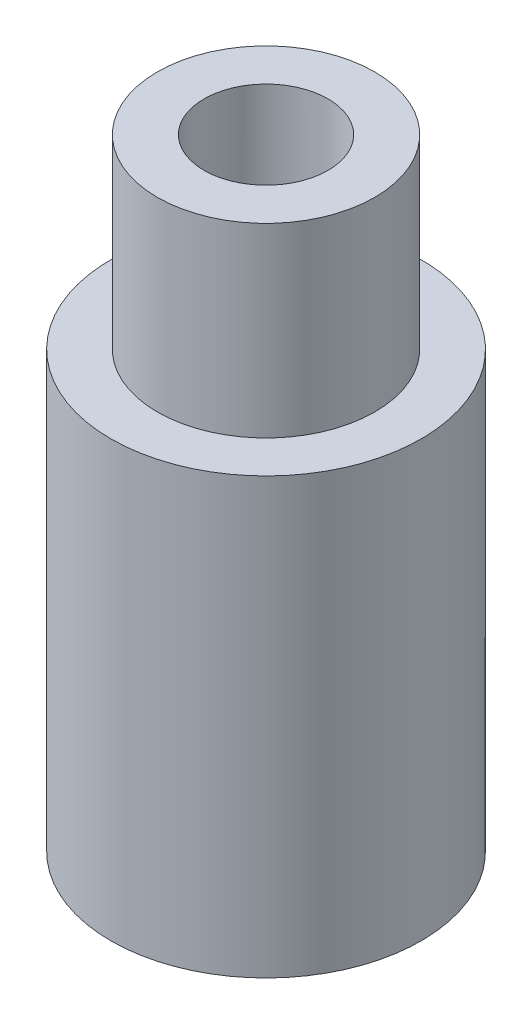
from build123d import *

# Parameters (mm, degrees)
SKETCH1_R           = 2.5019
BOSS_EXTRUDE1_DEPTH = 7.0104
SKETCH2_R           = 1.7526
BOSS_EXTRUDE2_DEPTH = 2.9972
SKETCH3_R           = 0.99949
CUT_EXTRUDE1_DEPTH  = 11.614662735
SKETCH4_R           = 1.9939
CUT_EXTRUDE2_DEPTH  = 6.985


with BuildPart() as part:
    # Sketch1 → Boss-Extrude1 (new body)
    with BuildSketch(Plane(origin=(0, 0, 0), x_dir=(1, 0, 0), z_dir=(0, 1, 0))):
        with Locations(Location((0, 0, 0), (0, 0, 270))):
            Circle(SKETCH1_R)
    extrude(amount=BOSS_EXTRUDE1_DEPTH)

    # Sketch2 → Boss-Extrude2 (add)
    with BuildSketch(Plane(origin=(0, 7.0104, 0), x_dir=(1, 0, 0), z_dir=(0, 1, 0))):
        with Locations(Location((0, 0, 0), (0, 0, 90))):
            Circle(SKETCH2_R)
    extrude(amount=BOSS_EXTRUDE2_DEPTH)

    # Sketch3 → Cut-Extrude1 (cut, through all)
    with BuildSketch(Plane(origin=(0, 10.0076, 0), x_dir=(1, 0, 0), z_dir=(0, 1, 0))):
        with Locations(Location((0, 0, 0), (0, 0, 270))):
            Circle(SKETCH3_R)
    extrude(amount=-CUT_EXTRUDE1_DEPTH, mode=Mode.SUBTRACT)

    # Sketch4 → Cut-Extrude2 (cut)
    with BuildSketch(Plane.XZ):
        with Locations(Location((0, 0, 0), (0, 0, 270))):
            Circle(SKETCH4_R)
    extrude(amount=-CUT_EXTRUDE2_DEPTH, mode=Mode.SUBTRACT)


solid = part.part
